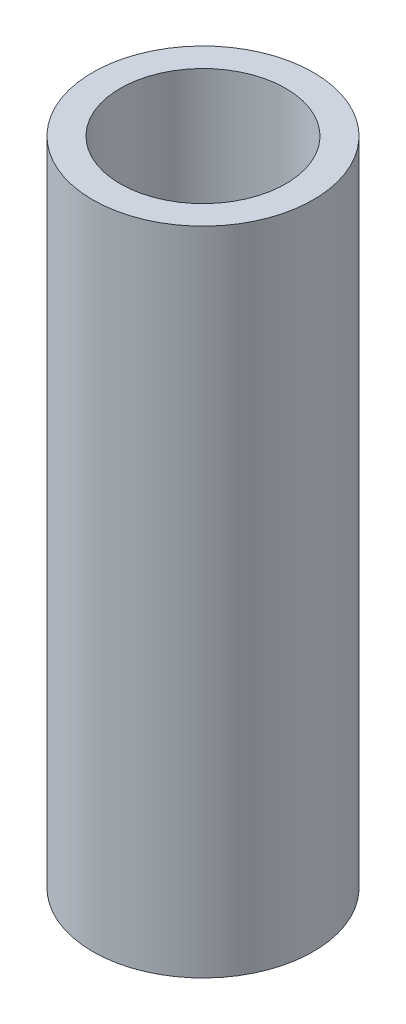
from build123d import *

# Parameters (mm, degrees)
SKETCH1_R      = 10
SKETCH1_R_2    = 7.5
EXTRUDE1_DEPTH = 59


with BuildPart() as part:
    # Sketch1 → Extrude1 (new body)
    with BuildSketch(Plane(origin=(0, 0, 0), x_dir=(1, 0, 0), z_dir=(0, 1, 0))):
        with Locations(Location((0, 0, 0), (0, 0, 270))):
            Circle(SKETCH1_R)
        with Locations(Location((0, 0, 0), (0, 0, 270))):
            Circle(SKETCH1_R_2, mode=Mode.SUBTRACT)
    extrude(amount=EXTRUDE1_DEPTH)


solid = part.part
